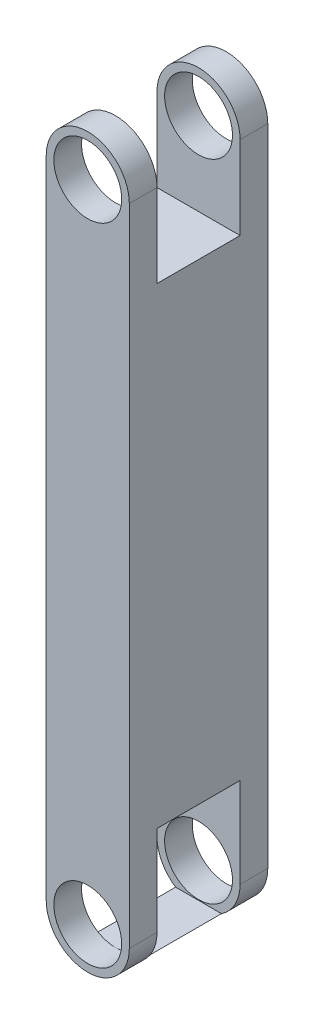
from build123d import *

# Parameters (mm, degrees)
ESTRUSIONE_ESTRUSIONE1_DEPTH      = 5
ESTRUSIONE_ESTRUSIONE1_DEPTH_BACK = 5
SCHIZZO1_R                        = 2.45
TAGLIO_ESTRUSIONE1_DEPTH          = 50.921702695
TAGLIO_ESTRUSIONE1_DEPTH_BACK     = 50.921702695
SCHIZZO2_W                        = 6
SCHIZZO2_H                        = 9


with BuildPart() as part:
    # Schizzo1 → Estrusione-Estrusione1 (new, two sides: drawn at the far end of the back side and taken through both)
    with BuildSketch(Plane.XY.offset(-ESTRUSIONE_ESTRUSIONE1_DEPTH_BACK)):
        with BuildLine():
            Line((-3, 0), (-3, 46.58))
            ThreePointArc((-3, 46.58), (0, 49.58), (3, 46.58))
            Line((3, 46.58), (3, 0))
            ThreePointArc((3, 0), (0, -3), (-3, 0))
        make_face()
        Circle(SCHIZZO1_R, mode=Mode.SUBTRACT)
        with Locations((0, 46.58)):
            Circle(SCHIZZO1_R, mode=Mode.SUBTRACT)
    extrude(amount=ESTRUSIONE_ESTRUSIONE1_DEPTH + ESTRUSIONE_ESTRUSIONE1_DEPTH_BACK)

    # Schizzo2 → Taglio-Estrusione1 (cut, two sides: drawn at the far end of the back side and taken through both)
    with BuildSketch(Plane(origin=(0, 0, 0), x_dir=(0, 0, -1), z_dir=(1, 0, 0)).offset(-TAGLIO_ESTRUSIONE1_DEPTH_BACK)):
        with Locations((0, 45.08)):
            Rectangle(SCHIZZO2_W, SCHIZZO2_H)
        with Locations((0, 2)):
            Rectangle(SCHIZZO2_W, SCHIZZO2_H)
    extrude(amount=TAGLIO_ESTRUSIONE1_DEPTH + TAGLIO_ESTRUSIONE1_DEPTH_BACK, mode=Mode.SUBTRACT)


solid = part.part
